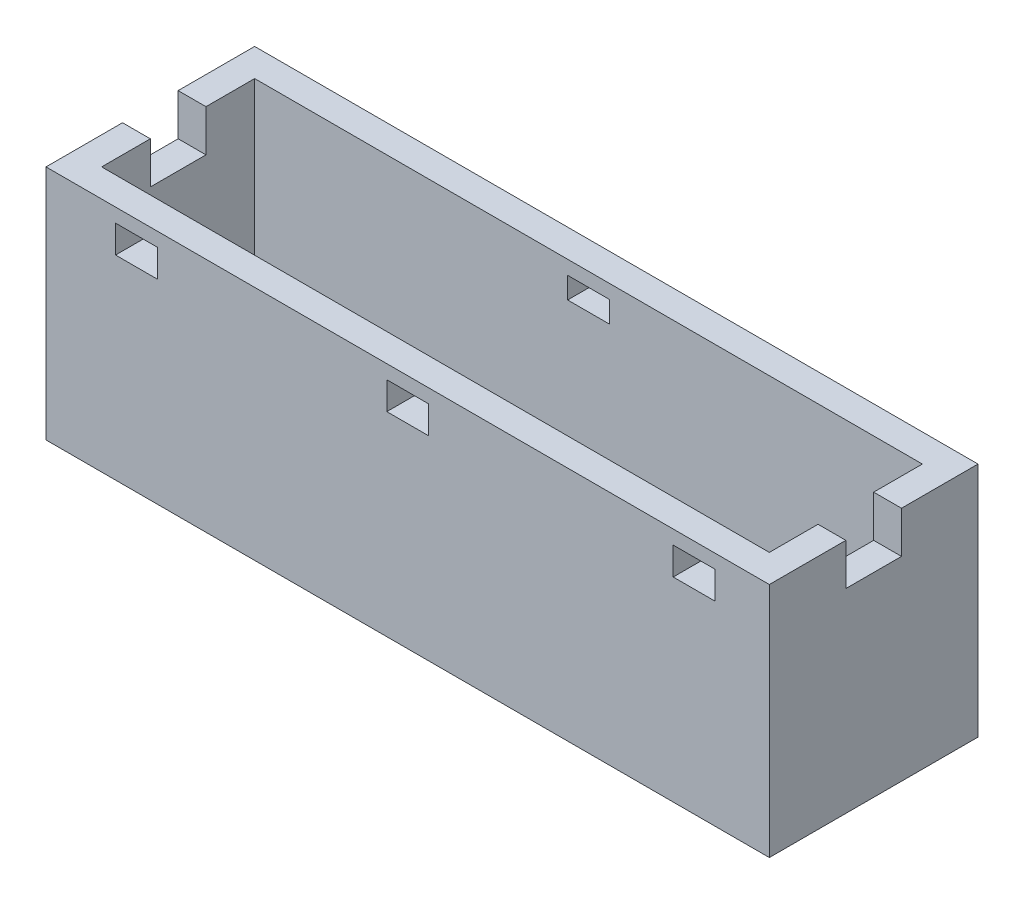
from build123d import *

# Parameters (mm, degrees)
SKETCH_1_W           = 520
SKETCH_1_H           = 150
EXTRUDE_1_DEPTH      = 140
SKETCH_2_W           = 480
SKETCH_2_H           = 110
CUT_EXTRUDE_1_DEPTH  = 120
SKETCH_11_W          = 40
SKETCH_11_H          = 30
CUT_EXTRUDE_3_DEPTH  = 544.714079273
SKETCH_13_W          = 520
SKETCH_13_H          = 150
EXTRUDE_6_DEPTH      = 30
SKETCH_18_W          = 30
SKETCH_18_H          = 15.352958973
CUT_EXTRUDE_8_DEPTH  = 30
SKETCH_21_W          = 30
SKETCH_21_H          = 19.875616275
CUT_EXTRUDE_9_DEPTH  = 30
SKETCH_22_W          = 30
SKETCH_22_H          = 19.88
CUT_EXTRUDE_10_DEPTH = 30
SKETCH_25_W          = 30
SKETCH_25_H          = 19.88
CUT_EXTRUDE_12_DEPTH = 30


with BuildPart() as part:
    # 草圖1 → 填料-伸長1 (new body)
    with BuildSketch(Plane(origin=(0, 0, 0), x_dir=(1, 0, 0), z_dir=(0, 1, 0))):
        Rectangle(SKETCH_1_W, SKETCH_1_H)
    extrude(amount=EXTRUDE_1_DEPTH)

    # 草圖2 → 除料-伸長1 (cut)
    with BuildSketch(Plane(origin=(0, 140, 0), x_dir=(1, 0, 0), z_dir=(0, 1, 0))):
        Rectangle(SKETCH_2_W, SKETCH_2_H)
    extrude(amount=-CUT_EXTRUDE_1_DEPTH, mode=Mode.SUBTRACT)

    # 草圖11 → 除料-伸長3 (cut, through all)
    with BuildSketch(Plane.ZY.offset(260)):
        with Locations((0, 125)):
            Rectangle(SKETCH_11_W, SKETCH_11_H)
    extrude(amount=-CUT_EXTRUDE_3_DEPTH, mode=Mode.SUBTRACT)

    # 草圖13 → 填料-伸長6 (add)
    with BuildSketch(Plane.XZ):
        Rectangle(SKETCH_13_W, SKETCH_13_H)
    extrude(amount=EXTRUDE_6_DEPTH)

    # 草圖18 → 除料-伸長8 (cut)
    with BuildSketch(Plane(origin=(0, 0, -75), x_dir=(-1, 0, 0), z_dir=(0, 0, -1))):
        with Locations((0, 122.323520514)):
            Rectangle(SKETCH_18_W, SKETCH_18_H)
    extrude(amount=-CUT_EXTRUDE_8_DEPTH, mode=Mode.SUBTRACT)

    # 草圖21 → 除料-伸長9 (cut)
    with BuildSketch(Plane.XY.offset(75)):
        with Locations((-195, 120.062191863)):
            Rectangle(SKETCH_21_W, SKETCH_21_H)
    extrude(amount=-CUT_EXTRUDE_9_DEPTH, mode=Mode.SUBTRACT)

    # 草圖22 → 除料-伸長10 (cut)
    with BuildSketch(Plane.XY.offset(75)):
        with Locations((0, 120.06)):
            Rectangle(SKETCH_22_W, SKETCH_22_H)
    extrude(amount=-CUT_EXTRUDE_10_DEPTH, mode=Mode.SUBTRACT)

    # 草圖25 → 除料-伸長12 (cut)
    with BuildSketch(Plane.XY.offset(75)):
        with Locations((205.891066665, 120.06)):
            Rectangle(SKETCH_25_W, SKETCH_25_H)
    extrude(amount=-CUT_EXTRUDE_12_DEPTH, mode=Mode.SUBTRACT)


solid = part.part
